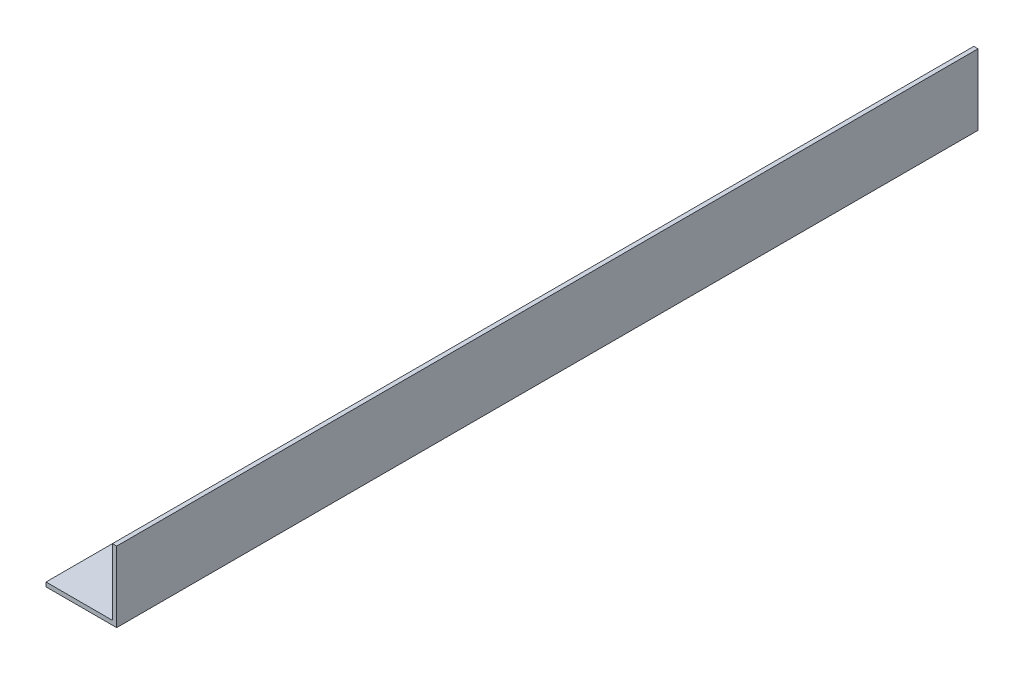
from build123d import *

# Parameters (mm, degrees)
BOSS_EXTRUDE1_DEPTH      = 304.8
BOSS_EXTRUDE1_DEPTH_BACK = 304.8


with BuildPart() as part:
    # Sketch3 → Boss-Extrude1 (new, two sides: drawn at the far end of the back side and taken through both)
    with BuildSketch(Plane.XY.offset(-BOSS_EXTRUDE1_DEPTH_BACK)):
        Polygon((-50, 0), (0, 0), (0, 50), (-3, 50), (-3, 3), (-50, 3), align=None)
    extrude(amount=BOSS_EXTRUDE1_DEPTH + BOSS_EXTRUDE1_DEPTH_BACK)


solid = part.part
